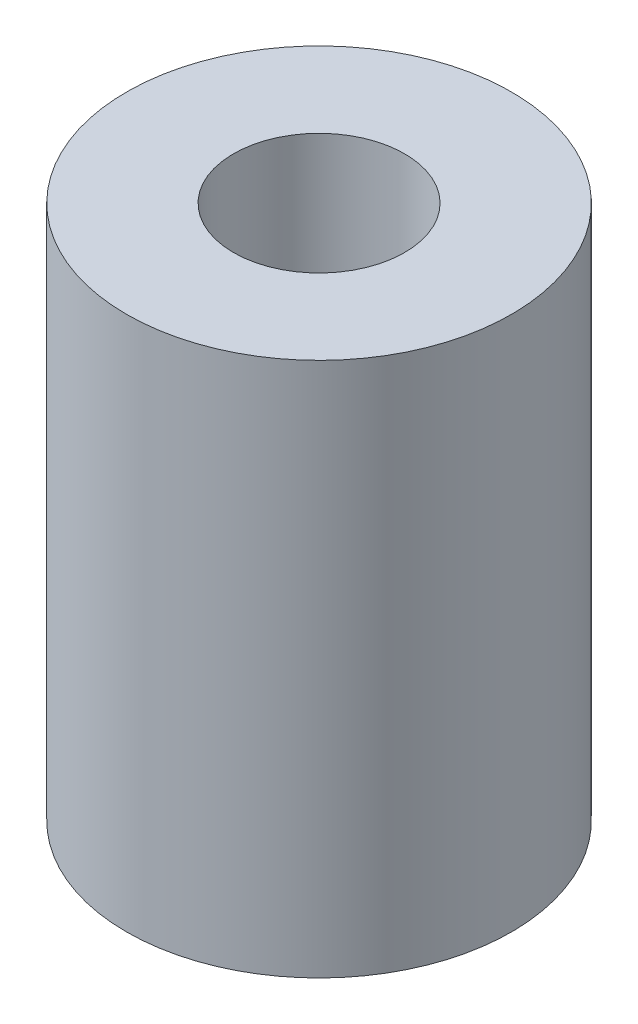
from build123d import *

# Parameters (mm, degrees)
SKETCH1_R           = 9
BOSS_EXTRUDE1_DEPTH = 12.5
CUT_EXTRUDE1_START  = -12.5
SKETCH2_R           = 4
CUT_EXTRUDE1_DEPTH  = 12.5
CUT_EXTRUDE2_REACH  = 30.054
SKETCH3_R           = 2.5


with BuildPart() as part:
    # Sketch1 → Boss-Extrude1 (new, symmetric)
    with BuildSketch(Plane(origin=(0, 0, 0), x_dir=(1, 0, 0), z_dir=(0, 1, 0))):
        with Locations(Location((0, 0, 0), (0, 0, 270))):
            Circle(SKETCH1_R)
    extrude(amount=BOSS_EXTRUDE1_DEPTH, both=True)

    # Sketch2 → Cut-Extrude1 (cut)
    with BuildSketch(Plane(origin=(0, 12.5, 0), x_dir=(1, 0, 0), z_dir=(0, 1, 0)).offset(CUT_EXTRUDE1_START)):
        with Locations(Location((0, 0, 0), (0, 0, 270))):
            Circle(SKETCH2_R)
    extrude(amount=CUT_EXTRUDE1_DEPTH, mode=Mode.SUBTRACT)

    # Sketch3 → Cut-Extrude2 (cut, up to next)
    with BuildSketch(Plane.XZ.offset(12.5), mode=Mode.PRIVATE) as cut_extrude2_sk1:
        with Locations(Location((0, 0, 0), (0, 0, 270))):
            Circle(SKETCH3_R)
    cut_extrude2_tool1 = extrude(cut_extrude2_sk1.sketch, amount=-CUT_EXTRUDE2_REACH, mode=Mode.PRIVATE) & part.part
    add(cut_extrude2_tool1.solids().sort_by_distance((0, -12.5, 0))[0], mode=Mode.SUBTRACT)


solid = part.part
